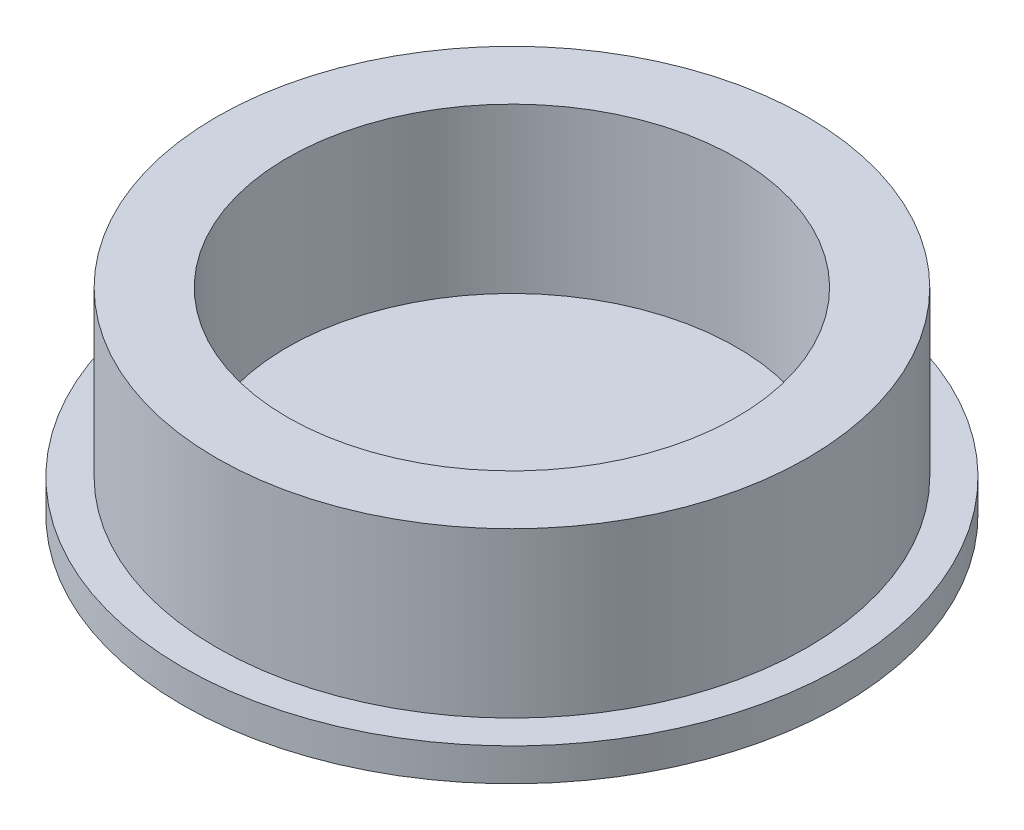
from build123d import *

# Parameters (mm, degrees)
SKETCH1_R           = 10.05
BOSS_EXTRUDE1_DEPTH = 1
SKETCH2_R           = 8.85
SKETCH2_R_2         = 6.85
BOSS_EXTRUDE2_DEPTH = 5
BOSS_EXTRUDE4_START = -5
SKETCH3_R           = 8.95
SKETCH3_R_2         = 6.85
BOSS_EXTRUDE4_DEPTH = 5
BOSS_EXTRUDE5_START = -5
SKETCH4_R           = 9.01
SKETCH4_R_2         = 6.85
BOSS_EXTRUDE5_DEPTH = 5


with BuildPart() as part:
    # Sketch1 → Boss-Extrude1 (new body)
    with BuildSketch(Plane(origin=(0, 0, 0), x_dir=(1, 0, 0), z_dir=(0, 1, 0))):
        with Locations(Location((0, 0, 0), (0, 0, 270))):
            Circle(SKETCH1_R)
    extrude(amount=BOSS_EXTRUDE1_DEPTH)

    # Sketch2 → Boss-Extrude2 (add)
    with BuildSketch(Plane(origin=(0, 1, 0), x_dir=(1, 0, 0), z_dir=(0, 1, 0))):
        with Locations(Location((0, 0, 0), (0, 0, 270))):
            Circle(SKETCH2_R)
        with Locations(Location((0, 0, 0), (0, 0, 270))):
            Circle(SKETCH2_R_2, mode=Mode.SUBTRACT)
    extrude(amount=BOSS_EXTRUDE2_DEPTH)

    # Sketch3 → Boss-Extrude4 (add)
    with BuildSketch(Plane(origin=(0, 6, 0), x_dir=(1, 0, 0), z_dir=(0, 1, 0)).offset(BOSS_EXTRUDE4_START)):
        with Locations(Location((0, 0, 0), (0, 0, 270))):
            Circle(SKETCH3_R)
        with Locations(Location((0, 0, 0), (0, 0, 270))):
            Circle(SKETCH3_R_2, mode=Mode.SUBTRACT)
    extrude(amount=BOSS_EXTRUDE4_DEPTH)

    # Sketch4 → Boss-Extrude5 (add)
    with BuildSketch(Plane(origin=(0, 6, 0), x_dir=(1, 0, 0), z_dir=(0, 1, 0)).offset(BOSS_EXTRUDE5_START)):
        with Locations(Location((0, 0, 0), (0, 0, 270))):
            Circle(SKETCH4_R)
        with Locations(Location((0, 0, 0), (0, 0, 270))):
            Circle(SKETCH4_R_2, mode=Mode.SUBTRACT)
    extrude(amount=BOSS_EXTRUDE5_DEPTH)


solid = part.part
